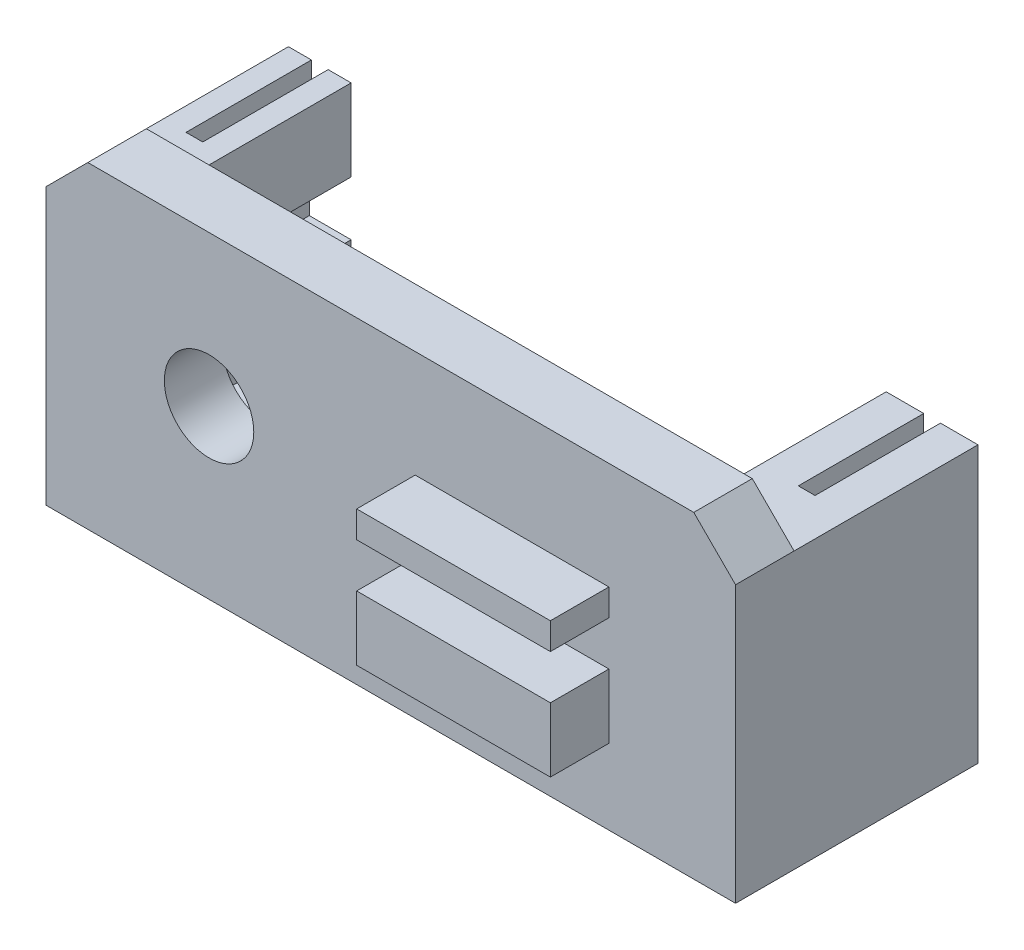
from build123d import *

# Parameters (mm, degrees)
SKETCH1_R           = 5.35
BOSS_EXTRUDE2_DEPTH = 7
SKETCH8_R           = 2.375
CUT_EXTRUDE2_DEPTH  = 2.25
BOSS_EXTRUDE3_DEPTH = 22
SKETCH10_W          = 82.482524805
SKETCH10_H          = 7
BOSS_EXTRUDE4_DEPTH = 5
CHAMFER1_SIZE       = 5
SKETCH11_W          = 39.19
SKETCH11_H          = 3
SKETCH11_W_2        = 21.55
CUT_EXTRUDE3_DEPTH  = 15
SKETCH12_W          = 23.17
SKETCH12_H          = 7.7
SKETCH12_H_2        = 3.2
BOSS_EXTRUDE5_DEPTH = 7


with BuildPart() as part:
    # Sketch1 → Boss-Extrude2 (new body)
    with BuildSketch(Plane.XY):
        Polygon((-19.503784034, 13), (-19.503784034, -20), (19.503784034, -20), (62.978740771, -20), (62.978740771, 13), (19.503784034, 13), align=None)
        Circle(SKETCH1_R, mode=Mode.SUBTRACT)
    extrude(amount=-BOSS_EXTRUDE2_DEPTH)

    # Sketch8 → Cut-Extrude2 (cut)
    with BuildSketch(Plane(origin=(0, 0, -7), x_dir=(-1, 0, 0), z_dir=(0, 0, -1))):
        with Locations((-11.35, 0)):
            Circle(SKETCH8_R)
    extrude(amount=-CUT_EXTRUDE2_DEPTH, mode=Mode.SUBTRACT)

    # Sketch9 → Boss-Extrude3 (add)
    with BuildSketch(Plane(origin=(0, 0, -7), x_dir=(-1, 0, 0), z_dir=(0, 0, -1))):
        Polygon((12.003784034, 3.25), (12.003784034, 13), (19.503784034, 13), (19.503784034, -12.662545792), (19.503784034, -20), (-56.5, -20), (-62.978740771, -20), (-62.978740771, 13), (-51.996215966, 13), (-51.996215966, 5), (-53.996215966, 5), (-53.996215966, -5), (-51.996215966, -5), (-51.996215966, -11.25), (12.003784034, -11.25), (12.003784034, -3.25), (17.003784034, -3.25), (17.003784034, 3.25), align=None)
    extrude(amount=BOSS_EXTRUDE3_DEPTH)

    # Sketch10 → Boss-Extrude4 (add)
    with BuildSketch(Plane(origin=(0, 13, 0), x_dir=(1, 0, 0), z_dir=(0, 1, 0))):
        with Locations((21.737478368, 3.5)):
            Rectangle(SKETCH10_W, SKETCH10_H)
    extrude(amount=BOSS_EXTRUDE4_DEPTH)

    # Chamfer1
    chamfer1_edges = [part.edges().sort_by_distance(p)[0] for p in [
        (62.978740771, 18, -3.5),
        (-19.503784034, 18, -3.5),
    ]]
    chamfer(chamfer1_edges, length=CHAMFER1_SIZE)

    # Sketch11 → Cut-Extrude3 (cut)
    with BuildSketch(Plane(origin=(0, 0, -29), x_dir=(-1, 0, 0), z_dir=(0, 0, -1))):
        Polygon((-60.239370385, 10), (-58.487478368, 10), (-58.487478368, 13), (-56.487478368, 13), (-56.487478368, 10), (-54.239370385, 10), (-54.239370385, 8), (-60.239370385, 8), align=None)
        with Locations((-40.644370385, -15.5)):
            Rectangle(SKETCH11_W, SKETCH11_H)
        with Locations((5.978784034, -15.5)):
            Rectangle(SKETCH11_W_2, SKETCH11_H)
        Polygon((14.753784034, 13), (16.753784034, 13), (16.753784034, 10), (18.753784034, 10), (18.753784034, 8), (12.753784034, 8), (12.753784034, 10), (14.753784034, 10), align=None)
    extrude(amount=-CUT_EXTRUDE3_DEPTH, mode=Mode.SUBTRACT)

    # Sketch12 → Boss-Extrude5 (add)
    with BuildSketch(Plane.XY):
        with Locations((36.243740771, -7.15)):
            Rectangle(SKETCH12_W, SKETCH12_H)
        with Locations((36.243740771, 3.6)):
            Rectangle(SKETCH12_W, SKETCH12_H_2)
    extrude(amount=BOSS_EXTRUDE5_DEPTH)


solid = part.part
